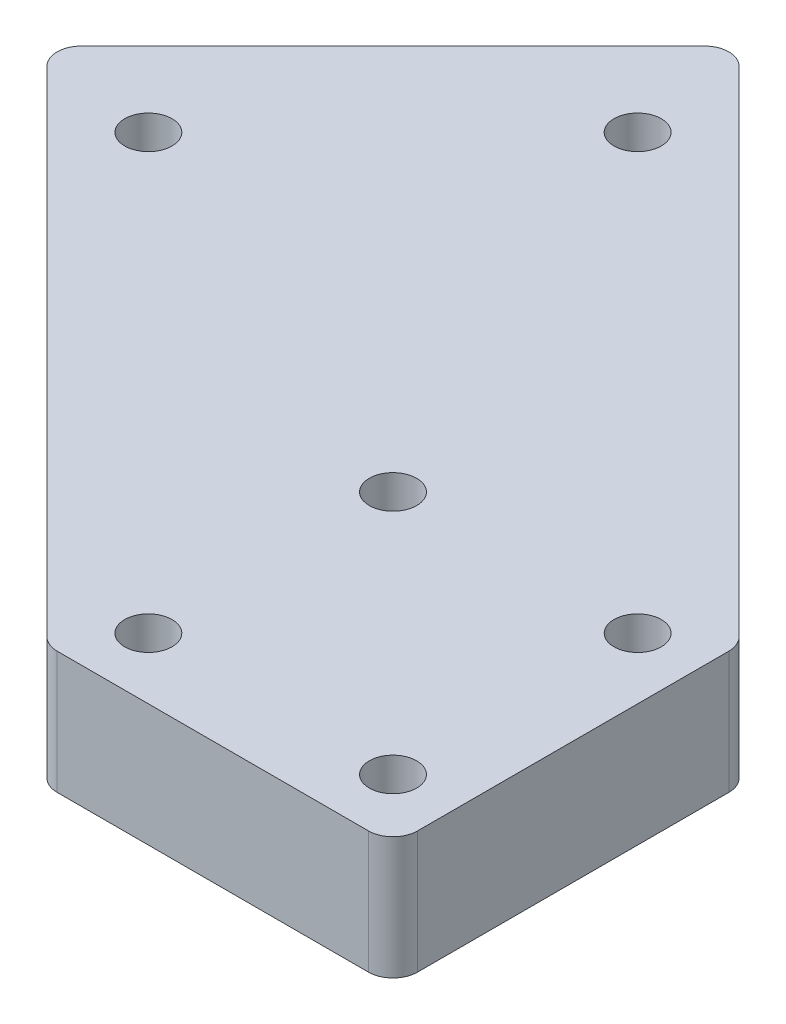
from build123d import *

# Parameters (mm, degrees)
SKETCH3_W             = 35.921024484
SKETCH3_H             = 35.921024484
BOSS_EXTRUDE2_DEPTH   = 12.7
BOSS_EXTRUDE3_DEPTH   = 25.4
F_8_CLEARANCE_HOLE1_D = 4.9149
F_8_CLEARANCE_HOLE2_D = 4.9149
SKETCH10_R            = 3.937
CUT_EXTRUDE1_DEPTH    = 6.35
FILLET1_R             = 2.54


with BuildPart() as part:
    # Sketch3 → Boss-Extrude2 (new body)
    with BuildSketch(Plane(origin=(0, 0, 0), x_dir=(1, 0, 0), z_dir=(0, 1, 0))):
        with Locations((17.960512242, -17.960512242)):
            Rectangle(SKETCH3_W, SKETCH3_H)
    extrude(amount=BOSS_EXTRUDE2_DEPTH)

    # Sketch4 → Boss-Extrude3 (add, symmetric)
    with BuildSketch(Plane(origin=(0, 0, 0), x_dir=(0.7071067811865476, 0, 0.7071067811865475), z_dir=(-0.7071067811865475, 0, 0.7071067811865476))):
        Polygon((25.4, 12.7), (-25.4, 12.7), (-50.8, 12.7), (-50.8, 0), (0, 0), (25.4, 0), align=None)
    extrude(amount=BOSS_EXTRUDE3_DEPTH, both=True)

    # #8 Clearance Hole1 (through all)
    with Locations(Plane(origin=(0, 0, 0), x_dir=(-1, 0, 0), z_dir=(0, -1, 0))):
        with Locations((-29.571024484, -29.571024484), (-4.171024484, -4.171024484), (-29.571024484, -4.171024484), (-4.171024484, -29.571024484)):
            Hole(F_8_CLEARANCE_HOLE1_D / 2)

    # #8 Clearance Hole2 (through all)
    with Locations(Plane(origin=(0, 12.7, 0), x_dir=(1, 0, 0), z_dir=(0, 1, 0))):
        with Locations((-40.855979707, 15.459815396), (-15.459815396, 40.855979707)):
            Hole(F_8_CLEARANCE_HOLE2_D / 2)

    # Sketch10 → Cut-Extrude1 (cut)
    with BuildSketch(Plane.XZ):
        with Locations(Location((-40.855979707, -15.459815396, 0), (0, 0, 270))):
            Circle(SKETCH10_R)
        with Locations(Location((-15.459815396, -40.855979707, 0), (0, 0, 270))):
            Circle(SKETCH10_R)
    extrude(amount=-CUT_EXTRUDE1_DEPTH, mode=Mode.SUBTRACT)

    # Fillet1
    fillet1_edges = [part.edges().sort_by_distance(p)[0] for p in [
        (-17.960512242, 6.35, -53.881536726),
        (-53.881536726, 6.35, -17.960512242),
        (35.921024484, 6.35, 0),
        (35.921024484, 6.35, 35.921024484),
        (0, 6.35, 35.921024484),
    ]]
    fillet(fillet1_edges, radius=FILLET1_R)


solid = part.part
